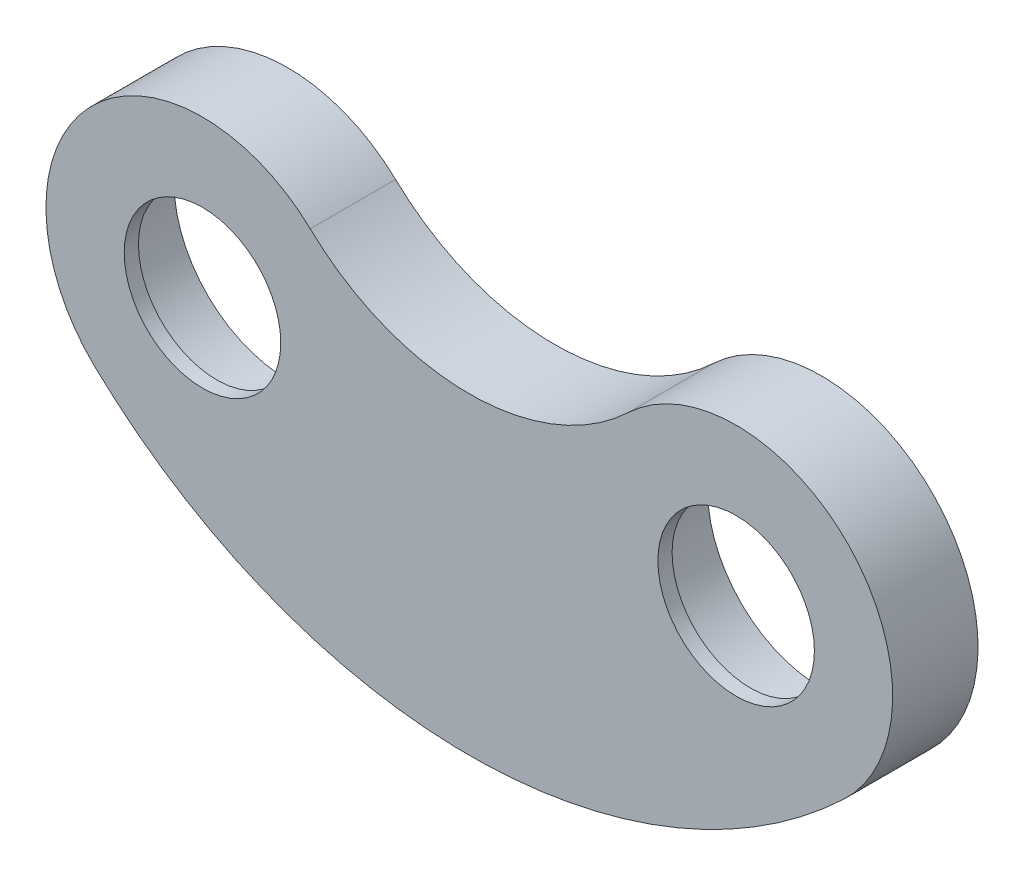
from build123d import *

# Parameters (mm, degrees)
CROQUIS1_R              = 11
SALIENTE_EXTRUIR1_DEPTH = 12
CROQUIS3_R              = 16
CORTAR_EXTRUIR2_DEPTH   = 10


with BuildPart() as part:
    # Croquis1 → Saliente-Extruir1 (new body)
    with BuildSketch(Plane.XY):
        with BuildLine():
            ThreePointArc((-26.771248385, 16.522500226), (-57.87296723, 15.696010738), (-57.046477743, -15.405708107))
            ThreePointArc((-57.046477743, -15.405708107), (-4.408863064, -36.394164074), (48.228751615, -15.405708107))
            ThreePointArc((48.228751615, -15.405708107), (49.055241102, 15.696010738), (17.953522257, 16.522500226))
            ThreePointArc((17.953522257, 16.522500226), (-4.408863064, 7.605835926), (-26.771248385, 16.522500226))
        make_face()
        with Locations((-41.908863064, 0.558396059)):
            Circle(CROQUIS1_R, mode=Mode.SUBTRACT)
        with Locations((33.091136936, 0.558396059)):
            Circle(CROQUIS1_R, mode=Mode.SUBTRACT)
    extrude(amount=SALIENTE_EXTRUIR1_DEPTH)

    # Croquis3 → Cortar-Extruir2 (cut)
    with BuildSketch(Plane(origin=(0, 0, 0), x_dir=(-1, 0, 0), z_dir=(0, 0, -1))):
        with Locations((41.908863064, 0.558396059)):
            Circle(CROQUIS3_R)
        with Locations((-33.091136936, 0.558396059)):
            Circle(CROQUIS3_R)
    extrude(amount=-CORTAR_EXTRUIR2_DEPTH, mode=Mode.SUBTRACT)


solid = part.part
